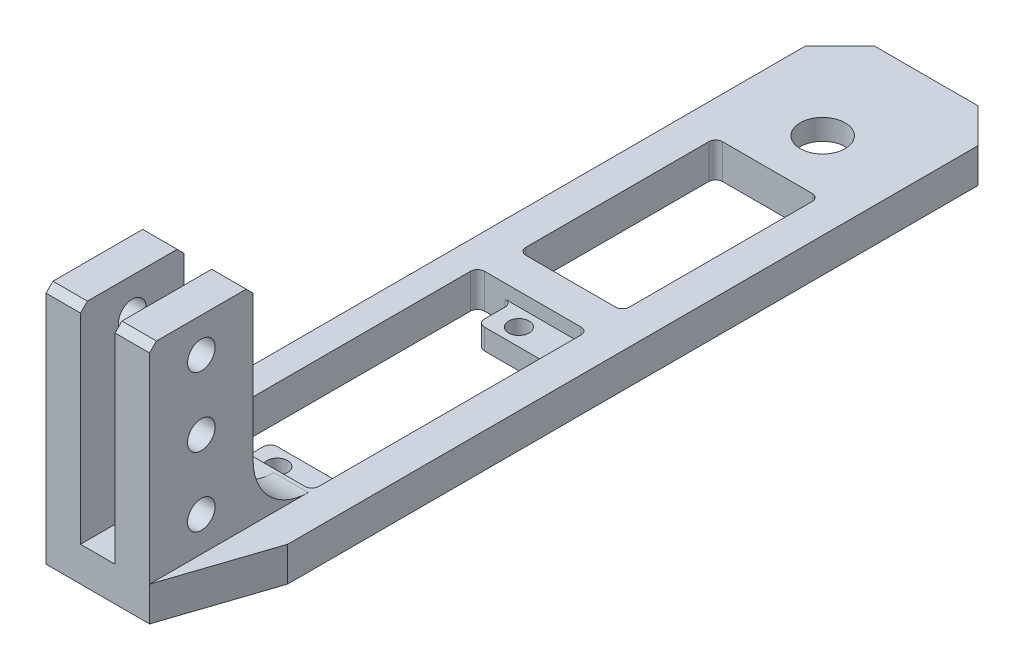
from build123d import *

# Parameters (mm, degrees)
SKETCH1_W           = 25
SKETCH1_H           = 120
BOSS_EXTRUDE1_DEPTH = 5
SKETCH2_W           = 5
SKETCH2_H           = 15
BOSS_EXTRUDE2_DEPTH = 30
CHAMFER1_SIZE       = 5
CHAMFER1_SIZE2      = 15
CHAMFER2_SIZE       = 15
CHAMFER2_SIZE2      = 5
CHAMFER3_SIZE       = 1
CHAMFER4_SIZE       = 5
CUT_EXTRUDE1_DEPTH  = 69.23672032
SKETCH3_3_W         = 11
SKETCH3_3_H         = 5
CUT_EXTRUDE2_DEPTH  = 2
FILLET1_R           = 1
SKETCH4_R           = 1.5
CUT_EXTRUDE3_DEPTH  = 70.139352036
FILLET2_R           = 8
SKETCH6_R           = 3.25
CUT_EXTRUDE5_DEPTH  = 69.23672032
CUT_EXTRUDE6_DEPTH  = 2
SKETCH8_W           = 2
SKETCH8_H           = 2.5
CUT_EXTRUDE7_DEPTH  = 1
SKETCH9_R           = 2
CUT_EXTRUDE8_DEPTH  = 73.284161474
SKETCH10_W          = 15
SKETCH10_H          = 28.5
CUT_EXTRUDE9_DEPTH  = 69.23672032
FILLET3_R           = 1


with BuildPart() as part:
    # Sketch1 → Boss-Extrude1 (new body)
    with BuildSketch(Plane(origin=(0, 0, 0), x_dir=(1, 0, 0), z_dir=(0, 1, 0))):
        Rectangle(SKETCH1_W, SKETCH1_H)
    extrude(amount=BOSS_EXTRUDE1_DEPTH)

    # Sketch2 → Boss-Extrude2 (add)
    with BuildSketch(Plane(origin=(0, 5, 0), x_dir=(1, 0, 0), z_dir=(0, 1, 0))):
        with Locations((-5, -52.5)):
            Rectangle(SKETCH2_W, SKETCH2_H)
        with Locations((5, -52.5)):
            Rectangle(SKETCH2_W, SKETCH2_H)
    extrude(amount=BOSS_EXTRUDE2_DEPTH)

    # Chamfer1
    chamfer1_edges = [part.edges().sort_by_distance(p)[0] for p in [
        (12.5, 2.5, 60),
    ]]
    chamfer1_side = [part.faces().sort_by_distance(p)[0] for p in [
        (-12.069883737, 2.5, 60),
    ]]
    chamfer(chamfer1_edges, length=CHAMFER1_SIZE, length2=CHAMFER1_SIZE2, reference=chamfer1_side[0])

    # Chamfer2
    chamfer2_edges = [part.edges().sort_by_distance(p)[0] for p in [
        (-12.5, 2.5, 60),
    ]]
    chamfer2_side = [part.faces().sort_by_distance(p)[0] for p in [
        (-12.5, 2.5, 0),
    ]]
    chamfer(chamfer2_edges, length=CHAMFER2_SIZE, length2=CHAMFER2_SIZE2, reference=chamfer2_side[0])

    # Chamfer3
    chamfer3_edges = [part.edges().sort_by_distance(p)[0] for p in [
        (5, 35, 60),
        (-5, 35, 60),
        (-5, 35, 45),
        (5, 35, 45),
    ]]
    chamfer(chamfer3_edges, length=CHAMFER3_SIZE)

    # Chamfer4
    chamfer4_edges = [part.edges().sort_by_distance(p)[0] for p in [
        (-12.5, 2.5, -60),
        (12.5, 2.5, -60),
    ]]
    chamfer(chamfer4_edges, length=CHAMFER4_SIZE)

    # Sketch3 → Cut-Extrude1 (cut, through all)
    with BuildSketch(Plane(origin=(0, 5, 0), x_dir=(1, 0, 0), z_dir=(0, 1, 0))):
        Polygon((-8.5, 3.5), (-8.5, -36.5), (-3.5, -36.5), (-3.5, -31.5), (7.5, -31.5), (7.5, -1.5), (-3.5, -1.5), (-3.5, 3.5), align=None)
    extrude(amount=-CUT_EXTRUDE1_DEPTH, mode=Mode.SUBTRACT)

    # Sketch3<3> → Cut-Extrude2 (cut)
    with BuildSketch(Plane(origin=(0, 5, 0), x_dir=(1, 0, 0), z_dir=(0, 1, 0))):
        with Locations((2, -34)):
            Rectangle(SKETCH3_3_W, SKETCH3_3_H)
        with Locations((2, 1)):
            Rectangle(SKETCH3_3_W, SKETCH3_3_H)
    extrude(amount=-CUT_EXTRUDE2_DEPTH, mode=Mode.SUBTRACT)

    # Fillet1
    fillet1_edges = [part.edges().sort_by_distance(p)[0] for p in [
        (7.5, 4, 36.5),
        (-3.5, 1.5, 31.5),
        (-3.5, 1.5, 36.5),
        (-8.5, 2.5, 36.5),
        (-3.5, 1.5, 1.5),
        (-3.5, 1.5, -3.5),
        (7.5, 4, -3.5),
        (-8.5, 2.5, -3.5),
    ]]
    fillet(fillet1_edges, radius=FILLET1_R)

    # Sketch4 → Cut-Extrude3 (cut, through all)
    with BuildSketch(Plane(origin=(0, 3, 0), x_dir=(1, 0, 0), z_dir=(0, 1, 0))):
        with Locations((0, 1)):
            Circle(SKETCH4_R)
        with Locations((0, -34)):
            Circle(SKETCH4_R)
    extrude(amount=-CUT_EXTRUDE3_DEPTH, mode=Mode.SUBTRACT)

    # Fillet2
    fillet2_edges = [part.edges().sort_by_distance(p)[0] for p in [
        (-5, 5, 45),
        (5, 5, 45),
    ]]
    fillet(fillet2_edges, radius=FILLET2_R)

    # Sketch6 → Cut-Extrude5 (cut, through all)
    with BuildSketch(Plane(origin=(0, 5, 0), x_dir=(1, 0, 0), z_dir=(0, 1, 0))):
        with Locations((0, 45)):
            Circle(SKETCH6_R)
    extrude(amount=-CUT_EXTRUDE5_DEPTH, mode=Mode.SUBTRACT)

    # Sketch7 → Cut-Extrude6 (cut)
    with BuildSketch(Plane.XZ):
        with BuildLine():
            Line((-6.684870979, -39.75), (6.684870979, -39.75))
            ThreePointArc((6.684870979, -39.75), (8.5, -45), (6.684870979, -50.25))
            Line((6.684870979, -50.25), (-6.684870979, -50.25))
            ThreePointArc((-6.684870979, -50.25), (-8.5, -45), (-6.684870979, -39.75))
        make_face()
    extrude(amount=-CUT_EXTRUDE6_DEPTH, mode=Mode.SUBTRACT)

    # Sketch8 → Cut-Extrude7 (cut)
    with BuildSketch(Plane.XZ.offset(-2)):
        with Locations((-7.5, -45)):
            Rectangle(SKETCH8_W, SKETCH8_H)
    extrude(amount=-CUT_EXTRUDE7_DEPTH, mode=Mode.SUBTRACT)

    # Sketch9 → Cut-Extrude8 (cut, through all)
    with BuildSketch(Plane(origin=(7.5, 0, 0), x_dir=(0, 0, -1), z_dir=(1, 0, 0))):
        with Locations((-52.5, 30)):
            Circle(SKETCH9_R)
        with Locations((-52.5, 20)):
            Circle(SKETCH9_R)
        with Locations((-52.5, 10)):
            Circle(SKETCH9_R)
    extrude(amount=-CUT_EXTRUDE8_DEPTH, mode=Mode.SUBTRACT)

    # Sketch10 → Cut-Extrude9 (cut, through all)
    with BuildSketch(Plane(origin=(0, 5, 0), x_dir=(1, 0, 0), z_dir=(0, 1, 0))):
        with Locations((0, 22.75)):
            Rectangle(SKETCH10_W, SKETCH10_H)
    extrude(amount=-CUT_EXTRUDE9_DEPTH, mode=Mode.SUBTRACT)

    # Fillet3
    fillet3_edges = [part.edges().sort_by_distance(p)[0] for p in [
        (-7.5, 2.5, -8.5),
        (7.5, 2.5, -8.5),
        (7.5, 2.5, -37),
        (-7.5, 2.5, -37),
    ]]
    fillet(fillet3_edges, radius=FILLET3_R)


solid = part.part
